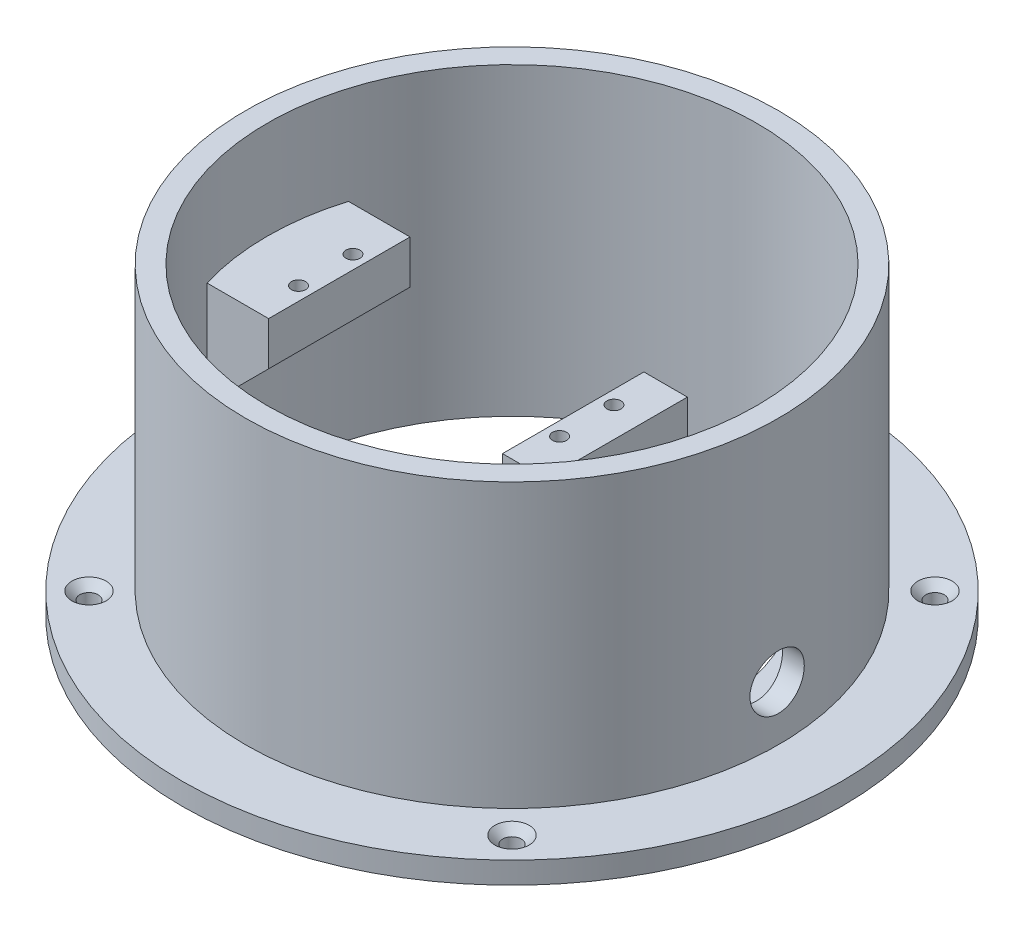
from build123d import *

# Parameters (mm, degrees)
SKETCH1_R                                           = 60.625
SKETCH1_R_2                                         = 45
BOSS_EXTRUDE1_DEPTH                                 = 4
SKETCH2_R                                           = 49
SKETCH2_R_2                                         = 45
BOSS_EXTRUDE2_DEPTH                                 = 52
SKETCH4_W                                           = 13.25
SKETCH4_H                                           = 8
SKETCH4_W_2                                         = 8
SKETCH4_H_2                                         = 38
BOSS_EXTRUDE4_DEPTH                                 = 13
BOSS_EXTRUDE5_DEPTH                                 = 4
SKETCH7_R                                           = 1.3
CUT_EXTRUDE4_DEPTH                                  = 7.2
SKETCH9_W                                           = 10
SKETCH9_H                                           = 24
CUT_EXTRUDE7_DEPTH                                  = 8
CUT_EXTRUDE8_REACH                                  = 139.219
CUT_EXTRUDE8_END_RADIUS                             = 45
SKETCH11_R                                          = 5
CUT_EXTRUDE9_DEPTH                                  = 101.273532203
CSK_FOR_M3_COUNTERSUNK_FLAT_HEAD_SCREW1_D           = 3.4
CSK_FOR_M3_COUNTERSUNK_FLAT_HEAD_SCREW1_CSINK_D     = 6.3
CSK_FOR_M3_COUNTERSUNK_FLAT_HEAD_SCREW1_CSINK_ANGLE = 90


with BuildPart() as part:
    # Sketch1 → Boss-Extrude1 (new body)
    with BuildSketch(Plane(origin=(0, 0, 0), x_dir=(1, 0, 0), z_dir=(0, 1, 0))):
        with Locations(Location((0, 0, 0), (0, 0, 270))):
            Circle(SKETCH1_R)
        with Locations(Location((0, 0, 0), (0, 0, 270))):
            Circle(SKETCH1_R_2, mode=Mode.SUBTRACT)
    extrude(amount=BOSS_EXTRUDE1_DEPTH)

    # Sketch2 → Boss-Extrude2 (add)
    with BuildSketch(Plane(origin=(0, 4, 0), x_dir=(1, 0, 0), z_dir=(0, 1, 0))):
        with Locations(Location((0, 0, 0), (0, 0, 90))):
            Circle(SKETCH2_R)
        with Locations(Location((0, 0, 0), (0, 0, 270))):
            Circle(SKETCH2_R_2, mode=Mode.SUBTRACT)
    extrude(amount=BOSS_EXTRUDE2_DEPTH)

    # Sketch4 → Boss-Extrude4 (add, symmetric)
    with BuildSketch(Plane.XY):
        with Locations((-38.375, 34)):
            Rectangle(SKETCH4_W, SKETCH4_H)
        Polygon((-31.75, 30), (-45, 30), (-45, 16.75), align=None)
        with Locations((15.25, 19)):
            Rectangle(SKETCH4_W_2, SKETCH4_H_2)
    extrude(amount=BOSS_EXTRUDE4_DEPTH, both=True)


with BuildPart() as boss_extrude4_piece_1:
    # of the separate pieces the step leaves, piece 1, a body of its own (boss_extrude4_pieces)
    add(part.part.solids().sort_by_distance((0, 0, 60.625))[0])



with BuildPart() as boss_extrude4_piece_2:
    # of the separate pieces the step leaves, piece 2, a body of its own (boss_extrude4_pieces)
    add(part.part.solids().sort_by_distance((11.25, 38, -13))[0])


with BuildPart() as boss_extrude4_piece_1_1:
    add(boss_extrude4_piece_1.part)

    add(boss_extrude4_piece_2.part)  # Boss-Extrude5 merges Boss-Extrude4 piece 2
    # Sketch5 → Boss-Extrude5 (add)
    with BuildSketch(Plane.XZ):
        with BuildLine():
            Line((11.25, 13), (29.067400866, 34.352382842))
            ThreePointArc((29.067400866, 34.352382842), (45, 0), (29.067400866, -34.352382842))
            Line((29.067400866, -34.352382842), (11.25, -13))
            Line((11.25, -13), (11.25, 13))
        make_face()
    extrude(amount=-BOSS_EXTRUDE5_DEPTH)

    # Sketch7 → Cut-Extrude4 (cut)
    with BuildSketch(Plane(origin=(0, 38, 0), x_dir=(1, 0, 0), z_dir=(0, 1, 0))):
        with Locations(Location((-34.25, 5, 0), (0, 0, 180))):
            Circle(SKETCH7_R)
        with Locations(Location((-34.25, -5, 0), (0, 0, 180))):
            Circle(SKETCH7_R)
        with Locations(Location((13.75, 5, 0), (0, 0, 180))):
            Circle(SKETCH7_R)
        with Locations(Location((13.75, -5, 0), (0, 0, 180))):
            Circle(SKETCH7_R)
    extrude(amount=-CUT_EXTRUDE4_DEPTH, mode=Mode.SUBTRACT)

    # Sketch9 → Cut-Extrude7 (cut)
    with BuildSketch(Plane.ZY.offset(-11.25)):
        with Locations((0, 17)):
            Rectangle(SKETCH9_W, SKETCH9_H)
    extrude(amount=-CUT_EXTRUDE7_DEPTH, mode=Mode.SUBTRACT)

    # Cut-Extrude8: up to this cylinder (the profile starts outside it)
    cut_extrude8_end = Plane(origin=(0, 14, 0), z_dir=(0, -1, 0)) * Cylinder(CUT_EXTRUDE8_END_RADIUS, 369.438, mode=Mode.PRIVATE)
    # Sketch11 → Cut-Extrude8 (cut, up to the surface)
    with BuildSketch(Plane(origin=(49, 0, 0), x_dir=(0, 0, -1), z_dir=(1, 0, 0)), mode=Mode.PRIVATE) as cut_extrude8_sk1:
        with Locations((0, 14)):
            Circle(SKETCH11_R)
    cut_extrude8_tool1 = extrude(cut_extrude8_sk1.sketch, amount=-CUT_EXTRUDE8_REACH, mode=Mode.PRIVATE) - cut_extrude8_end
    add(cut_extrude8_tool1.solids().sort_by_distance((49, 14, 0))[0], mode=Mode.SUBTRACT)

    # Sketch12 → Cut-Extrude9 (cut, through all)
    with BuildSketch(Plane(origin=(0, 4, 0), x_dir=(1, 0, 0), z_dir=(0, 1, 0))):
        with BuildLine():
            Line((29.479537487, 22.359715328), (27.25, 19.687836398))
            Line((27.25, 19.687836398), (27.25, -19.687836398))
            Line((27.25, -19.687836398), (29.479537487, -22.359715328))
            ThreePointArc((29.479537487, -22.359715328), (37, 0), (29.479537487, 22.359715328))
        make_face()
        Polygon((27.25, -19.687836398), (27.25, 19.687836398), (24.25, 16.092634774), (24.25, -16.092634774), align=None)
    extrude(amount=-CUT_EXTRUDE9_DEPTH, mode=Mode.SUBTRACT)

    # CSK for M3 Countersunk Flat Head Screw1 (through all)
    with Locations(Plane(origin=(0, 4, 0), x_dir=(1, 0, 0), z_dir=(0, 1, 0))):
        with Locations((-38.890872965, 38.890872965), (-38.890872965, -38.890872965), (38.890872965, -38.890872965), (38.890872965, 38.890872965)):
            CounterSinkHole(CSK_FOR_M3_COUNTERSUNK_FLAT_HEAD_SCREW1_D / 2, CSK_FOR_M3_COUNTERSUNK_FLAT_HEAD_SCREW1_CSINK_D / 2, counter_sink_angle=CSK_FOR_M3_COUNTERSUNK_FLAT_HEAD_SCREW1_CSINK_ANGLE)


solid = boss_extrude4_piece_1_1.part
